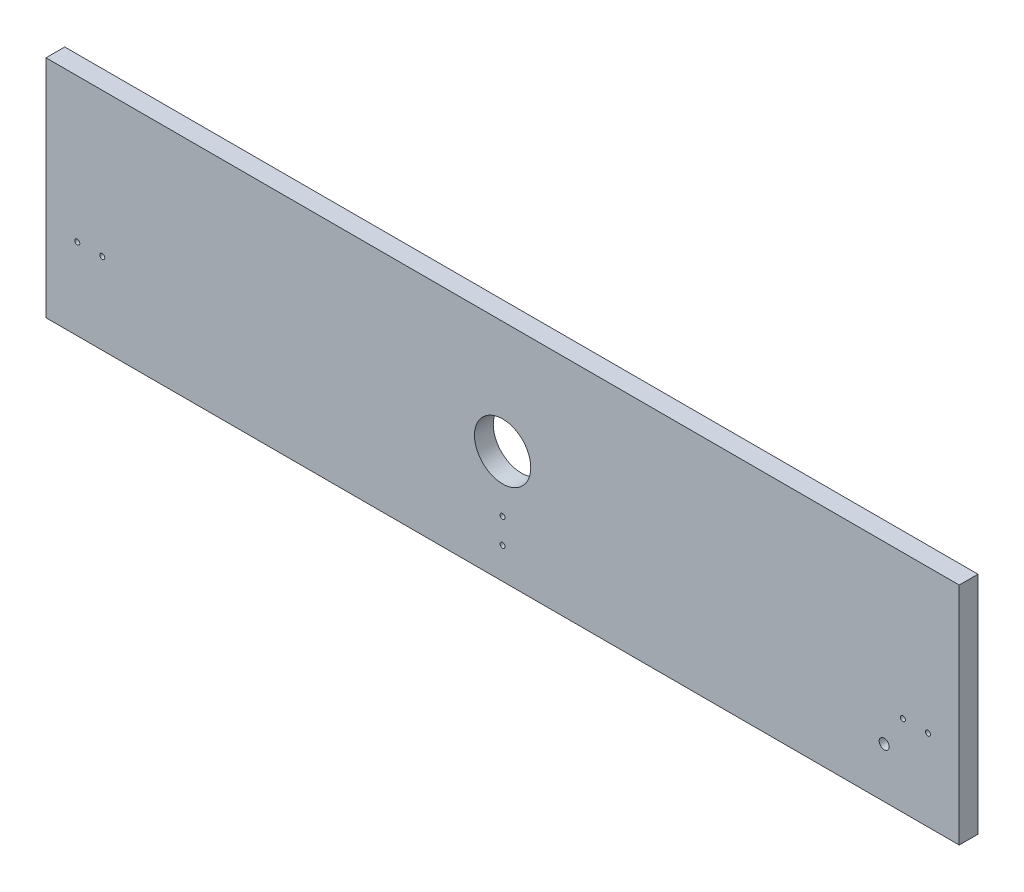
from build123d import *

# Parameters (mm, degrees)
CROQUIS1_W              = 730
CROQUIS1_H              = 180
SALIENTE_EXTRUIR1_DEPTH = 15
CROQUIS2_R              = 2
CORTAR_EXTRUIR1_DEPTH   = 10
CROQUIS3_R              = 22.5
CORTAR_EXTRUIR2_DEPTH   = 15
CROQUIS4_R              = 4
CORTAR_EXTRUIR3_DEPTH   = 15


with BuildPart() as part:
    # Croquis1 → Saliente-Extruir1 (new body)
    with BuildSketch(Plane.XY):
        Rectangle(CROQUIS1_W, CROQUIS1_H)
    extrude(amount=SALIENTE_EXTRUIR1_DEPTH)

    # Croquis2 → Cortar-Extruir1 (cut)
    with BuildSketch(Plane.XY.offset(15)):
        with Locations((-340, -25)):
            Circle(CROQUIS2_R)
        with Locations((0, -65)):
            Circle(CROQUIS2_R)
        with Locations((0, -45)):
            Circle(CROQUIS2_R)
        with Locations((-320, -25)):
            Circle(CROQUIS2_R)
        with Locations((340, -25)):
            Circle(CROQUIS2_R)
        with Locations((320, -25)):
            Circle(CROQUIS2_R)
    extrude(amount=-CORTAR_EXTRUIR1_DEPTH, mode=Mode.SUBTRACT)

    # Croquis3 → Cortar-Extruir2 (cut)
    with BuildSketch(Plane.XY.offset(15)):
        Circle(CROQUIS3_R)
    extrude(amount=-CORTAR_EXTRUIR2_DEPTH, mode=Mode.SUBTRACT)

    # Croquis4 → Cortar-Extruir3 (cut)
    with BuildSketch(Plane(origin=(0, 0, 0), x_dir=(-1, 0, 0), z_dir=(0, 0, -1))):
        with Locations((-305, -50)):
            Circle(CROQUIS4_R)
    extrude(amount=-CORTAR_EXTRUIR3_DEPTH, mode=Mode.SUBTRACT)


solid = part.part
